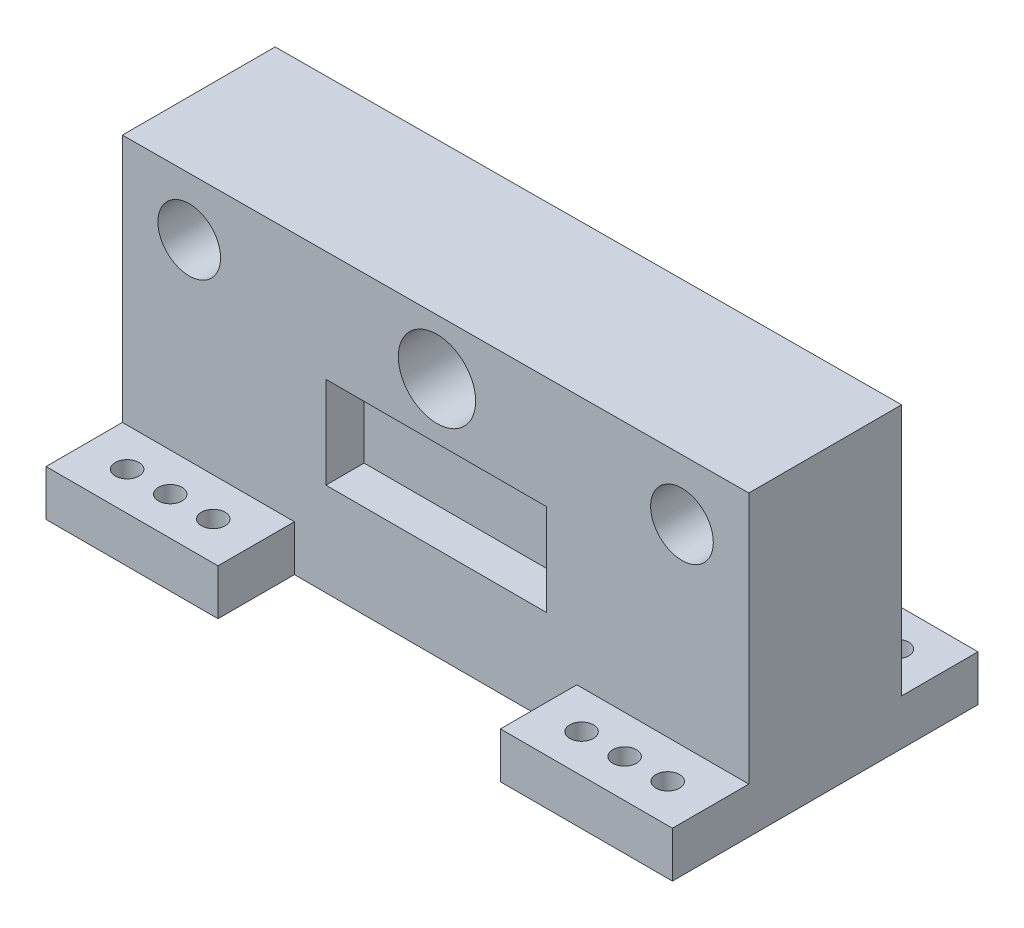
from build123d import *

# Parameters (mm, degrees)
SKETCH_1_W               = 22.514200142
SKETCH_1_H               = 10.000016773
SKETCH_1_R               = 1.55
SKETCH_1_W_2             = 82
SKETCH_1_H_2             = 20
EXTRUDE_3_DEPTH          = 6
SKETCH_3_W               = 82
SKETCH_3_H               = 20
EXTRUDE_4_DEPTH          = 49
SKETCH_5_R               = 4.1
CUT_EXTRUDE_2_DEPTH      = 15
SKETCH_6_R               = 5.06
CUT_EXTRUDE_3_DEPTH      = 15
CUT_EXTRUDE_4_DEPTH      = 75.87323291
CUT_EXTRUDE_4_DEPTH_BACK = 75.87323291
SKETCH_7_W               = 28.844452319
SKETCH_7_H               = 12
CUT_EXTRUDE_5_DEPTH      = 5


with BuildPart() as part:
    # Эскиз1 → Бобышка-Вытянуть3 (new body)
    # profile 1 of 5: a face of its own
    with BuildSketch(Plane(origin=(0, 0, 0), x_dir=(1, 0, 0), z_dir=(0, 1, 0))):
        with Locations((-29.742899929, 15.000008387)):
            Rectangle(SKETCH_1_W, SKETCH_1_H)
        with Locations(Location((-35.379367801, 15.000008387, 0), (0, 0, 270))):
            Circle(SKETCH_1_R, mode=Mode.SUBTRACT)
        with Locations(Location((-29.739367801, 15.000008387, 0), (0, 0, 270))):
            Circle(SKETCH_1_R, mode=Mode.SUBTRACT)
        with Locations(Location((-24.106432057, 15.000008387, 0), (0, 0, 270))):
            Circle(SKETCH_1_R, mode=Mode.SUBTRACT)
    # profile 2 of 5: a face of its own
    with BuildSketch(Plane(origin=(0, 0, 0), x_dir=(1, 0, 0), z_dir=(0, 1, 0))):
        Rectangle(SKETCH_1_W_2, SKETCH_1_H_2)
    # profile 3 of 5: a face of its own
    with BuildSketch(Plane(origin=(0, 0, 0), x_dir=(1, 0, 0), z_dir=(0, 1, 0))):
        with Locations((-29.742899929, -15.000008387)):
            Rectangle(SKETCH_1_W, SKETCH_1_H)
        with Locations(Location((-35.379367801, -15.000008387, 0), (0, 0, 270))):
            Circle(SKETCH_1_R, mode=Mode.SUBTRACT)
        with Locations(Location((-29.739367801, -15.000008387, 0), (0, 0, 270))):
            Circle(SKETCH_1_R, mode=Mode.SUBTRACT)
        with Locations(Location((-24.106432057, -15.000008387, 0), (0, 0, 270))):
            Circle(SKETCH_1_R, mode=Mode.SUBTRACT)
    # profile 4 of 5: a face of its own
    with BuildSketch(Plane(origin=(0, 0, 0), x_dir=(1, 0, 0), z_dir=(0, 1, 0))):
        with Locations((29.742899929, -15.000008387)):
            Rectangle(SKETCH_1_W, SKETCH_1_H)
        with Locations(Location((24.106432057, -15.000008387, 0), (0, 0, 270))):
            Circle(SKETCH_1_R, mode=Mode.SUBTRACT)
        with Locations(Location((29.739367801, -15.000008387, 0), (0, 0, 270))):
            Circle(SKETCH_1_R, mode=Mode.SUBTRACT)
        with Locations(Location((35.379367801, -15.000008387, 0), (0, 0, 270))):
            Circle(SKETCH_1_R, mode=Mode.SUBTRACT)
    # profile 5 of 5: a face of its own
    with BuildSketch(Plane(origin=(0, 0, 0), x_dir=(1, 0, 0), z_dir=(0, 1, 0))):
        with Locations((29.742899929, 15.000008387)):
            Rectangle(SKETCH_1_W, SKETCH_1_H)
        with Locations(Location((24.106432057, 15.000008387, 0), (0, 0, 270))):
            Circle(SKETCH_1_R, mode=Mode.SUBTRACT)
        with Locations(Location((29.739367801, 15.000008387, 0), (0, 0, 270))):
            Circle(SKETCH_1_R, mode=Mode.SUBTRACT)
        with Locations(Location((35.379367801, 15.000008387, 0), (0, 0, 270))):
            Circle(SKETCH_1_R, mode=Mode.SUBTRACT)
    extrude(amount=EXTRUDE_3_DEPTH)

    # Эскиз3 → Бобышка-Вытянуть4 (add)
    with BuildSketch(Plane(origin=(0, 6, 0), x_dir=(1, 0, 0), z_dir=(0, 1, 0))):
        Rectangle(SKETCH_3_W, SKETCH_3_H)
    extrude(amount=EXTRUDE_4_DEPTH)

    # Эскиз5 → Вырез-Вытянуть2 (cut)
    with BuildSketch(Plane.XY.offset(10)):
        with Locations((32.25, 31.072649375)):
            Circle(SKETCH_5_R)
        with Locations(Location((-32.25, 31.072649375, 0), (0, 0, 180))):
            Circle(SKETCH_5_R)
    extrude(amount=-CUT_EXTRUDE_2_DEPTH, mode=Mode.SUBTRACT)

    # Эскиз6 → Вырез-Вытянуть3 (cut)
    with BuildSketch(Plane.XY.offset(10)):
        with Locations((0.178742266, 31.522649375)):
            Circle(SKETCH_6_R)
    extrude(amount=-CUT_EXTRUDE_3_DEPTH, mode=Mode.SUBTRACT)

    # Эскиз4 → Вырез-Вытянуть4 (cut, two sides: drawn at the far end of the back side and taken through both)
    with BuildSketch(Plane(origin=(0, 0, -10), x_dir=(-1, 0, 0), z_dir=(0, 0, -1)).offset(-CUT_EXTRUDE_4_DEPTH_BACK)):
        Polygon((41, 39), (41, 38.572649375), (-41, 39), (-41, 55), (41, 55), align=None)
    extrude(amount=CUT_EXTRUDE_4_DEPTH + CUT_EXTRUDE_4_DEPTH_BACK, mode=Mode.SUBTRACT)

    # Эскиз7 → Вырез-Вытянуть5 (cut)
    with BuildSketch(Plane.XY.offset(10)):
        with Locations((0.061520834, 18.208477718)):
            Rectangle(SKETCH_7_W, SKETCH_7_H)
    extrude(amount=-CUT_EXTRUDE_5_DEPTH, mode=Mode.SUBTRACT)


solid = part.part
